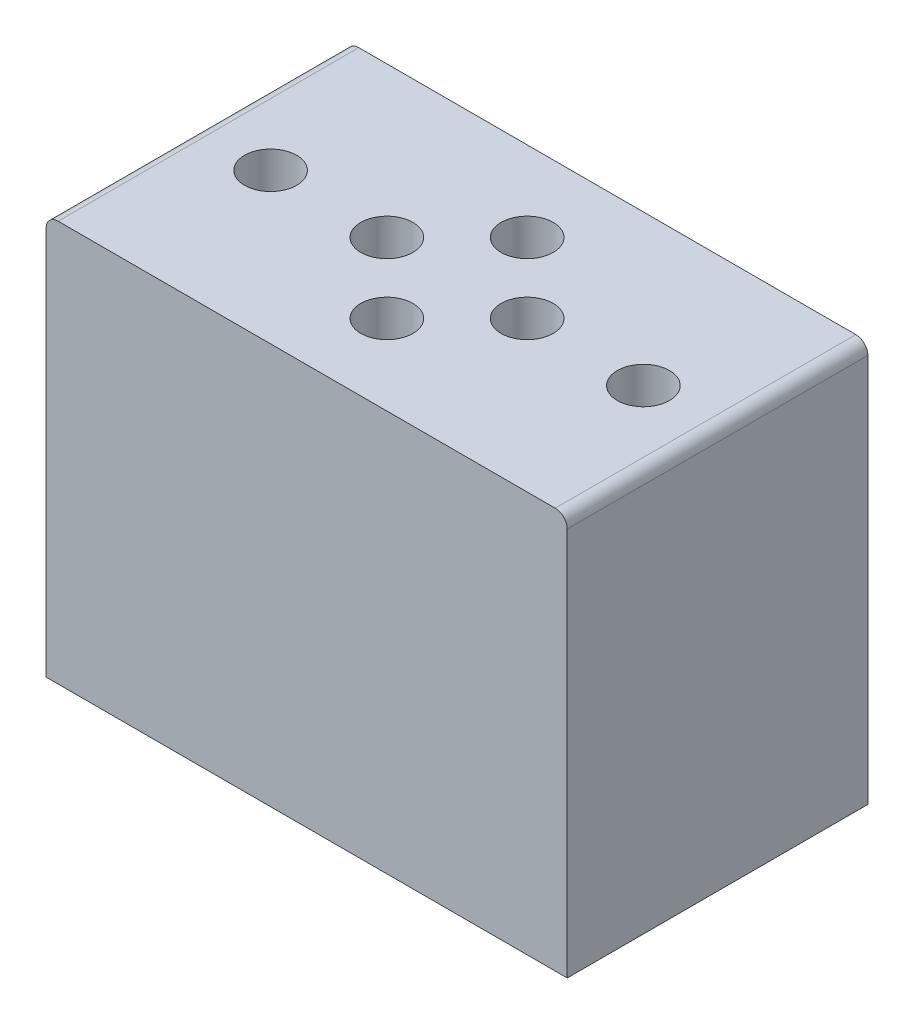
from build123d import *

# Parameters (mm, degrees)
BOSS_EXTRUDE1_DEPTH = 20
BOSS_EXTRUDE2_START = 10
BOSS_EXTRUDE2_DEPTH = 10
SKETCH4_R           = 2.6
CUT_EXTRUDE2_DEPTH  = 6
CUT_EXTRUDE3_REACH  = 49.399
SKETCH2_R           = 6.6


with BuildPart() as part:
    # Sketch1 → Boss-Extrude1 (new body)
    with BuildSketch(Plane.XY):
        with BuildLine():
            Line((-33.49686368, 14.646798017), (16.10313632, 14.646798017))
            ThreePointArc((16.10313632, 14.646798017), (16.951664458, 14.295326155), (17.30313632, 13.446798017))
            Line((17.30313632, 13.446798017), (17.30313632, -25.353201983))
            Line((17.30313632, -25.353201983), (-34.69686368, -25.353201983))
            Line((-34.69686368, -25.353201983), (-34.69686368, 13.446798017))
            ThreePointArc((-34.69686368, 13.446798017), (-34.345391817, 14.295326155), (-33.49686368, 14.646798017))
        make_face()
    extrude(amount=-BOSS_EXTRUDE1_DEPTH)

    # Sketch3 → Boss-Extrude2 (add)
    with BuildSketch(Plane.XY.offset(BOSS_EXTRUDE2_START)):
        with BuildLine():
            Line((17.30313632, -25.353201983), (17.30313632, 13.446798017))
            ThreePointArc((17.30313632, 13.446798017), (16.951664458, 14.295326155), (16.10313632, 14.646798017))
            Line((16.10313632, 14.646798017), (-33.49686368, 14.646798017))
            ThreePointArc((-33.49686368, 14.646798017), (-34.345391817, 14.295326155), (-34.69686368, 13.446798017))
            Line((-34.69686368, 13.446798017), (-34.69686368, -25.353201983))
            Line((-34.69686368, -25.353201983), (17.30313632, -25.353201983))
        make_face()
    extrude(amount=-BOSS_EXTRUDE2_DEPTH)

    # Sketch4 → Cut-Extrude2 (cut)
    with BuildSketch(Plane(origin=(0, 14.646798017, 0), x_dir=(1, 0, 0), z_dir=(0, 1, 0))):
        with Locations(Location((-27.29686368, 5, 0), (0, 0, 270))):
            Circle(SKETCH4_R)
        with Locations(Location((-15.69686368, 5, 0), (0, 0, 270))):
            Circle(SKETCH4_R)
        with Locations(Location((-8.69686368, 12, 0), (0, 0, 270))):
            Circle(SKETCH4_R)
        with Locations(Location((-8.69686368, -2, 0), (0, 0, 270))):
            Circle(SKETCH4_R)
        with Locations(Location((-1.69686368, 5, 0), (0, 0, 270))):
            Circle(SKETCH4_R)
        with Locations(Location((9.90313632, 5, 0), (0, 0, 270))):
            Circle(SKETCH4_R)
    extrude(amount=-CUT_EXTRUDE2_DEPTH, mode=Mode.SUBTRACT)

    # Sketch2 → Cut-Extrude3 (cut, up to next)
    with BuildSketch(Plane.XY, mode=Mode.PRIVATE) as cut_extrude3_sk1:
        with Locations((-8.69686368, -5.353201983)):
            Circle(SKETCH2_R)
    cut_extrude3_tool1 = extrude(cut_extrude3_sk1.sketch, amount=-CUT_EXTRUDE3_REACH, mode=Mode.PRIVATE) & part.part
    add(cut_extrude3_tool1.solids().sort_by_distance((-8.696864, -5.353202, 0))[0], mode=Mode.SUBTRACT)


solid = part.part
